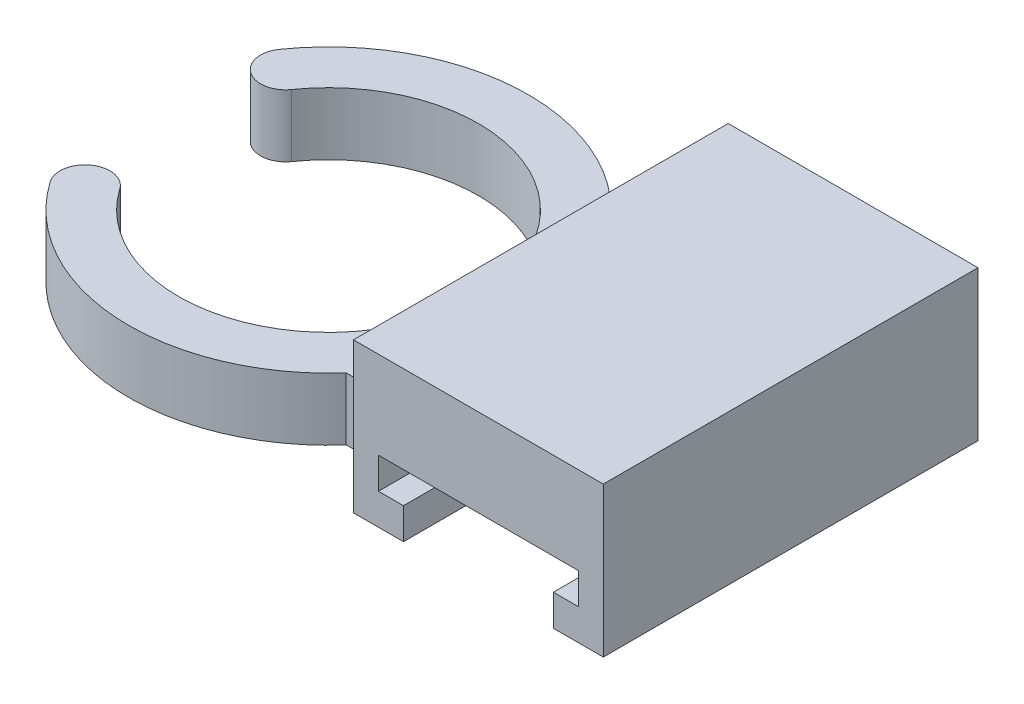
from build123d import *

# Parameters (mm, degrees)
EXTRUDE_1_DEPTH = 60
EXTRUDE_2_DEPTH = 10


with BuildPart() as part:
    # 草图1 → 凸台-拉伸1 (new body)
    with BuildSketch(Plane.XY):
        Polygon((-19.732146976, -1.598220465), (-11.732146976, -1.598220465), (-11.732146976, 3.401779535), (-15.732146976, 3.401779535), (-15.732146976, 8.401779535), (16.267853024, 8.401779535), (16.267853024, 3.401779535), (12.267853024, 3.401779535), (12.267853024, -1.598220465), (20.267853024, -1.598220465), (20.267853024, 22.401779535), (-19.732146976, 22.401779535), align=None)
    extrude(amount=EXTRUDE_1_DEPTH)

    # 草图2 → 凸台-拉伸2 (add)
    with BuildSketch(Plane.XZ.offset(1.598220465)):
        with BuildLine():
            Line((-29.732146976, 51.166010489), (-19.732146976, 51.166010489))
            Line((-19.732146976, 51.166010489), (-19.732146976, 8.833989511))
            Line((-19.732146976, 8.833989511), (-29.732146976, 8.833989511))
            ThreePointArc((-29.732146976, 8.833989511), (-55.52111794, -1.949954349), (-79.945012394, 11.645554037))
            ThreePointArc((-79.945012394, 11.645554037), (-78.962709962, 17.216467959), (-73.391796039, 16.234165528))
            ThreePointArc((-73.391796039, 16.234165528), (-29.732146976, 30), (-73.391796039, 43.765834472))
            ThreePointArc((-73.391796039, 43.765834472), (-78.962709962, 42.783532041), (-79.945012394, 48.354445963))
            ThreePointArc((-79.945012394, 48.354445963), (-55.52111794, 61.949954349), (-29.732146976, 51.166010489))
        make_face()
    extrude(amount=-EXTRUDE_2_DEPTH)


solid = part.part
